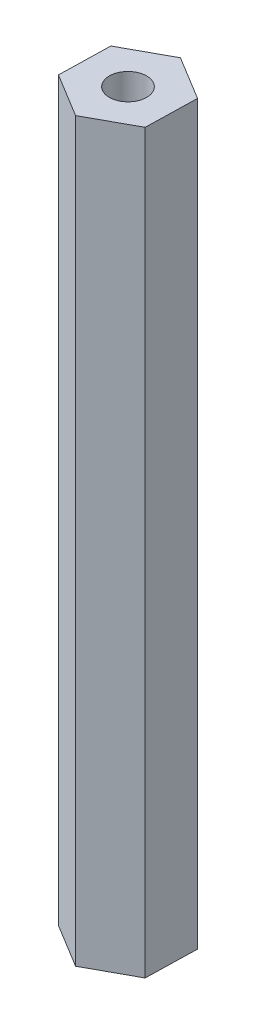
from build123d import *

# Parameters (mm, degrees)
BOSS_EXTRUDE1_DEPTH = 41.5
CUT_EXTRUDE1_START  = 41.5
SKETCH1_3_R         = 2.1
CUT_EXTRUDE1_DEPTH  = 84.704514495


with BuildPart() as part:
    # Sketch1 → Boss-Extrude1 (new, symmetric)
    with BuildSketch(Plane(origin=(0, 0, 0), x_dir=(1, 0, 0), z_dir=(0, 1, 0))):
        Polygon((5.065112622, 2.770914552), (0.132873917, 5.77197348), (-4.932238705, 3.001058928), (-5.065112622, -2.770914552), (-0.132873917, -5.77197348), (4.932238705, -3.001058928), align=None)
    extrude(amount=BOSS_EXTRUDE1_DEPTH, both=True)

    # Sketch1<3> → Cut-Extrude1 (cut, through all)
    with BuildSketch(Plane(origin=(0, 0, 0), x_dir=(1, 0, 0), z_dir=(0, 1, 0)).offset(CUT_EXTRUDE1_START)):
        Circle(SKETCH1_3_R)
    extrude(amount=-CUT_EXTRUDE1_DEPTH, mode=Mode.SUBTRACT)


solid = part.part
